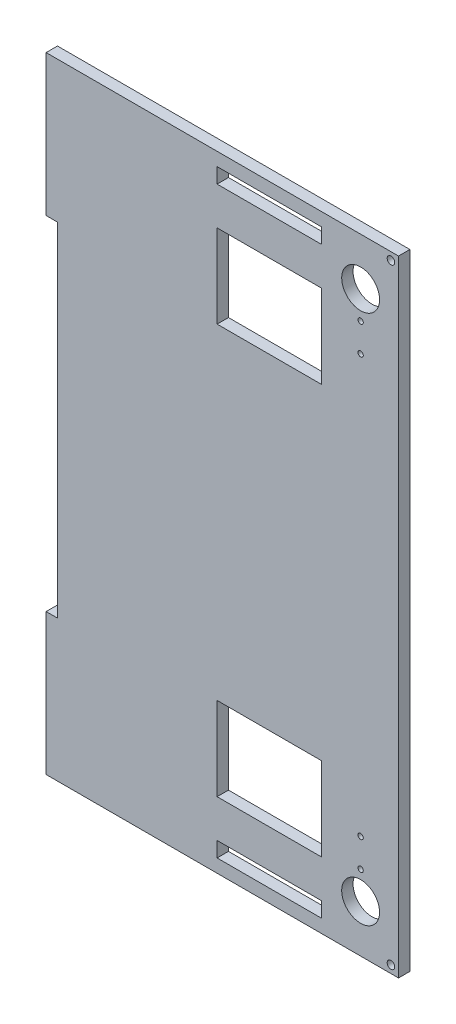
from build123d import *

# Parameters (mm, degrees)
ESQUISSE1_W             = 186
ESQUISSE1_H             = 330
BOSS_EXTRU_1_DEPTH      = 6
ESQUISSE3_R             = 2
ESQUISSE3_R_2           = 10
ESQUISSE3_R_3           = 1.4
ESQUISSE3_W             = 55
ESQUISSE3_H             = 8
ESQUISSE3_H_2           = 44
ENL_V_MAT_EXTRU_2_DEPTH = 6
ESQUISSE4_W             = 6
ESQUISSE4_H             = 181
ENL_V_MAT_EXTRU_3_DEPTH = 379.856173237


with BuildPart() as part:
    # Esquisse1 → Boss.-Extru.1 (new body)
    with BuildSketch(Plane.XY):
        with Locations((-93, 165)):
            Rectangle(ESQUISSE1_W, ESQUISSE1_H)
    extrude(amount=BOSS_EXTRU_1_DEPTH)

    # Esquisse3 → Enlèv. mat.-Extru.2 (cut)
    with BuildSketch(Plane.XY.offset(6)):
        with Locations((-4, 4)):
            Circle(ESQUISSE3_R)
        with Locations((-20, 25)):
            Circle(ESQUISSE3_R_2)
        with Locations((-20, 39.73)):
            Circle(ESQUISSE3_R_3)
        with Locations((-20, 54.73)):
            Circle(ESQUISSE3_R_3)
        with Locations(Location((-20, 275.27, 0), (0, 0, 180))):
            Circle(ESQUISSE3_R_3)
        with Locations(Location((-20, 290.27, 0), (0, 0, 180))):
            Circle(ESQUISSE3_R_3)
        with Locations(Location((-4, 326, 0), (0, 0, 180))):
            Circle(ESQUISSE3_R)
        with Locations(Location((-20, 305, 0), (0, 0, 180))):
            Circle(ESQUISSE3_R_2)
        with Locations((-68.25, 11)):
            Rectangle(ESQUISSE3_W, ESQUISSE3_H)
        with Locations((-68.25, 57)):
            Rectangle(ESQUISSE3_W, ESQUISSE3_H_2)
        with Locations((-68.25, 273)):
            Rectangle(ESQUISSE3_W, ESQUISSE3_H_2)
        with Locations((-68.25, 319)):
            Rectangle(ESQUISSE3_W, ESQUISSE3_H)
    extrude(amount=-ENL_V_MAT_EXTRU_2_DEPTH, mode=Mode.SUBTRACT)

    # Esquisse4 → Enlèv. mat.-Extru.3 (cut, through all)
    with BuildSketch(Plane(origin=(0, 0, 0), x_dir=(-1, 0, 0), z_dir=(0, 0, -1))):
        with Locations((183, 165)):
            Rectangle(ESQUISSE4_W, ESQUISSE4_H)
    extrude(amount=-ENL_V_MAT_EXTRU_3_DEPTH, mode=Mode.SUBTRACT)


solid = part.part
